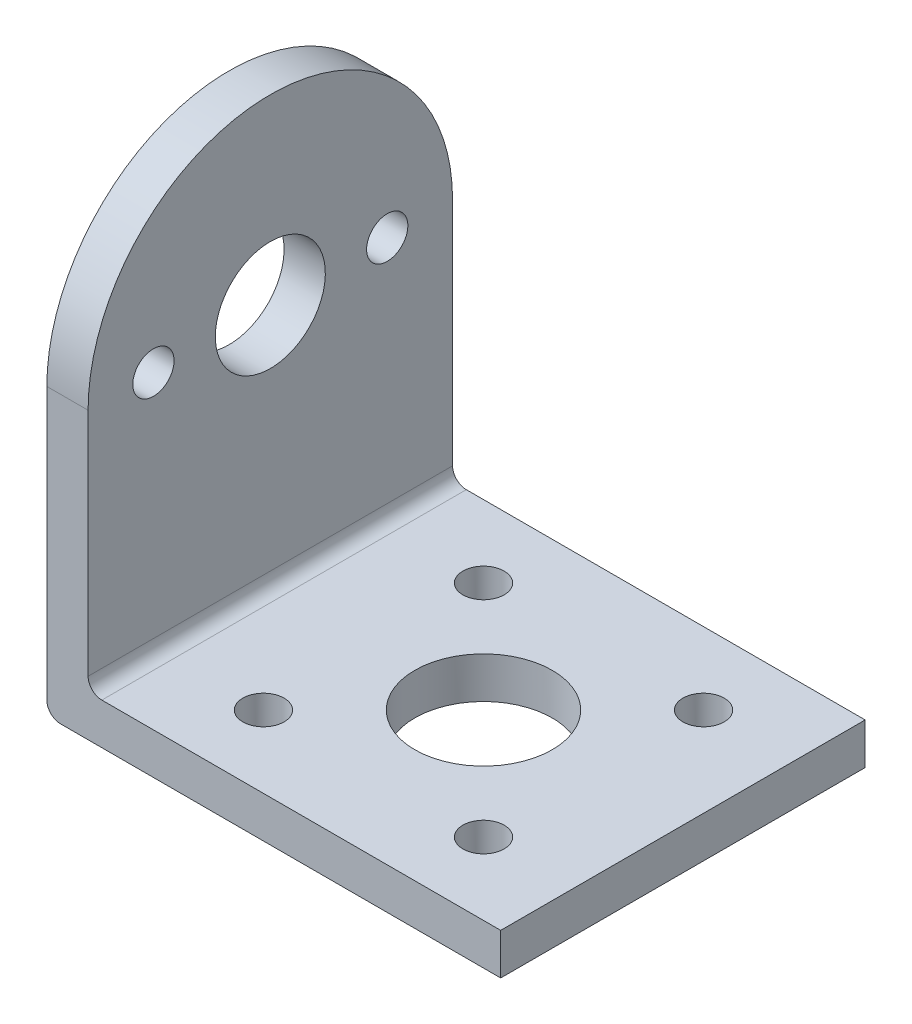
from build123d import *

# Parameters (mm, degrees)
EXTRUDE_1_DEPTH          = 26.5
SKETCH_3_R               = 1.5
CUT_EXTRUDE_1_DEPTH      = 53.519044165
SKETCH_3_3_R             = 4
CUT_EXTRUDE_2_DEPTH      = 53.519044165
CUT_EXTRUDE_3_DEPTH      = 53.46189093
CUT_EXTRUDE_3_DEPTH_BACK = 53.46189093
SKETCH_4_R               = 5
SKETCH_4_R_2             = 1.5


with BuildPart() as part:
    # 草图2 → 凸台-拉伸1 (new body)
    with BuildSketch(Plane.XY):
        with BuildLine():
            Line((0, 1), (0, 34))
            Line((0, 34), (3, 34))
            Line((3, 34), (3, 4))
            ThreePointArc((3, 4), (3.292893219, 3.292893219), (4, 3))
            Line((4, 3), (33, 3))
            Line((33, 3), (33, 0))
            Line((33, 0), (1, 0))
            ThreePointArc((1, 0), (0.292893219, 0.292893219), (0, 1))
        make_face()
    extrude(amount=EXTRUDE_1_DEPTH)

    # 草图3 → 切除-拉伸1 (cut, through all)
    with BuildSketch(Plane(origin=(3, 0, 0), x_dir=(0, 0, -1), z_dir=(1, 0, 0))):
        with Locations((-4.75, 20.75)):
            Circle(SKETCH_3_R)
        with BuildLine():
            ThreePointArc((-13.25, 34), (-3.880835149, 30.119164851), (0, 20.75))
            Line((0, 20.75), (0, 34))
            Line((0, 34), (-13.25, 34))
        make_face()
        with BuildLine():
            ThreePointArc((-26.5, 20.75), (-22.619164851, 30.119164851), (-13.25, 34))
            Line((-13.25, 34), (-26.5, 34))
            Line((-26.5, 34), (-26.5, 20.75))
        make_face()
        with Locations((-21.75, 20.75)):
            Circle(SKETCH_3_R)
    extrude(amount=-CUT_EXTRUDE_1_DEPTH, mode=Mode.SUBTRACT)

    # 草图3<3> → 切除-拉伸2 (cut, through all)
    with BuildSketch(Plane(origin=(3, 0, 0), x_dir=(0, 0, -1), z_dir=(1, 0, 0))):
        with Locations((-13.25, 20.75)):
            Circle(SKETCH_3_3_R)
    extrude(amount=-CUT_EXTRUDE_2_DEPTH, mode=Mode.SUBTRACT)

    # 草图4 → 切除-拉伸3 (cut, two sides: drawn at the far end of the back side and taken through both)
    with BuildSketch(Plane(origin=(0, 3, 0), x_dir=(1, 0, 0), z_dir=(0, 1, 0)).offset(-CUT_EXTRUDE_3_DEPTH_BACK)):
        with Locations((18.5, -13.25)):
            Circle(SKETCH_4_R)
        with Locations((26.5, -5.25)):
            Circle(SKETCH_4_R_2)
        with Locations((10.5, -5.25)):
            Circle(SKETCH_4_R_2)
        with Locations((10.5, -21.25)):
            Circle(SKETCH_4_R_2)
        with Locations((26.5, -21.25)):
            Circle(SKETCH_4_R_2)
    extrude(amount=CUT_EXTRUDE_3_DEPTH + CUT_EXTRUDE_3_DEPTH_BACK, mode=Mode.SUBTRACT)


solid = part.part
